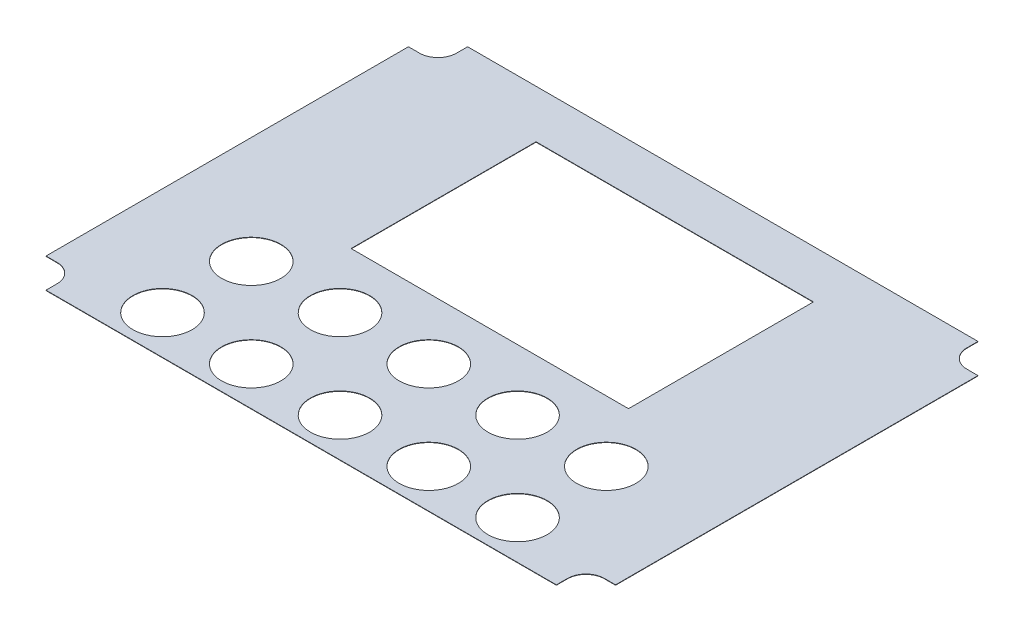
from build123d import *

# Parameters (mm, degrees)
SKETCH1_W           = 154
SKETCH1_H           = 114
BOSS_EXTRUDE1_DEPTH = 0.1
CUT_EXTRUDE1_DEPTH  = 3
SKETCH3_R           = 8
SKETCH3_W           = 75
SKETCH3_H           = 50
CUT_EXTRUDE2_DEPTH  = 1


with BuildPart() as part:
    # Sketch1 → Boss-Extrude1 (new body)
    with BuildSketch(Plane(origin=(0, 0, 0), x_dir=(1, 0, 0), z_dir=(0, 1, 0))):
        Rectangle(SKETCH1_W, SKETCH1_H)
    extrude(amount=BOSS_EXTRUDE1_DEPTH)

    # Sketch2 → Cut-Extrude1 (cut)
    with BuildSketch(Plane(origin=(0, 0.1, 0), x_dir=(1, 0, 0), z_dir=(0, 1, 0))):
        with BuildLine():
            Line((-52.05, -19.483379374), (-52.05, -25.516620626))
            ThreePointArc((-52.05, -25.516620626), (-48, -27.55), (-43.95, -25.516620626))
            Line((-43.95, -25.516620626), (-43.95, -19.483379374))
            ThreePointArc((-43.95, -19.483379374), (-48, -17.45), (-52.05, -19.483379374))
        make_face()
        with BuildLine():
            Line((-19.95, -19.483379374), (-19.95, -25.516620626))
            ThreePointArc((-19.95, -25.516620626), (-24, -27.55), (-28.05, -25.516620626))
            Line((-28.05, -25.516620626), (-28.05, -19.483379374))
            ThreePointArc((-28.05, -19.483379374), (-24, -17.45), (-19.95, -19.483379374))
        make_face()
        with BuildLine():
            Line((4.05, -19.483379374), (4.05, -25.516620626))
            ThreePointArc((4.05, -25.516620626), (0, -27.55), (-4.05, -25.516620626))
            Line((-4.05, -25.516620626), (-4.05, -19.483379374))
            ThreePointArc((-4.05, -19.483379374), (0, -17.45), (4.05, -19.483379374))
        make_face()
        with BuildLine():
            Line((28.05, -19.483379374), (28.05, -25.516620626))
            ThreePointArc((28.05, -25.516620626), (24, -27.55), (19.95, -25.516620626))
            Line((19.95, -25.516620626), (19.95, -19.483379374))
            ThreePointArc((19.95, -19.483379374), (24, -17.45), (28.05, -19.483379374))
        make_face()
        with BuildLine():
            Line((52.05, -19.483379374), (52.05, -25.516620626))
            ThreePointArc((52.05, -25.516620626), (48, -27.55), (43.95, -25.516620626))
            Line((43.95, -25.516620626), (43.95, -19.483379374))
            ThreePointArc((43.95, -19.483379374), (48, -17.45), (52.05, -19.483379374))
        make_face()
        with BuildLine():
            Line((-19.95, -43.483379374), (-19.95, -49.516620626))
            ThreePointArc((-19.95, -49.516620626), (-24, -51.55), (-28.05, -49.516620626))
            Line((-28.05, -49.516620626), (-28.05, -43.483379374))
            ThreePointArc((-28.05, -43.483379374), (-24, -41.45), (-19.95, -43.483379374))
        make_face()
        with BuildLine():
            Line((4.05, -43.483379374), (4.05, -49.516620626))
            ThreePointArc((4.05, -49.516620626), (0, -51.55), (-4.05, -49.516620626))
            Line((-4.05, -49.516620626), (-4.05, -43.483379374))
            ThreePointArc((-4.05, -43.483379374), (0, -41.45), (4.05, -43.483379374))
        make_face()
        with BuildLine():
            Line((28.05, -43.483379374), (28.05, -49.516620626))
            ThreePointArc((28.05, -49.516620626), (24, -51.55), (19.95, -49.516620626))
            Line((19.95, -49.516620626), (19.95, -43.483379374))
            ThreePointArc((19.95, -43.483379374), (24, -41.45), (28.05, -43.483379374))
        make_face()
        with BuildLine():
            Line((52.05, -43.483379374), (52.05, -49.516620626))
            ThreePointArc((52.05, -49.516620626), (48, -51.55), (43.95, -49.516620626))
            Line((43.95, -49.516620626), (43.95, -43.483379374))
            ThreePointArc((43.95, -43.483379374), (48, -41.45), (52.05, -43.483379374))
        make_face()
        with BuildLine():
            Line((-43.95, -43.483379374), (-43.95, -49.516620626))
            ThreePointArc((-43.95, -49.516620626), (-48, -51.55), (-52.05, -49.516620626))
            Line((-52.05, -49.516620626), (-52.05, -43.483379374))
            ThreePointArc((-52.05, -43.483379374), (-48, -41.45), (-43.95, -43.483379374))
        make_face()
    extrude(amount=-CUT_EXTRUDE1_DEPTH, mode=Mode.SUBTRACT)

    # Sketch3 → Cut-Extrude2 (cut)
    # profile 1 of 15: a face of its own
    with BuildSketch(Plane(origin=(0, 0.1, 0), x_dir=(1, 0, 0), z_dir=(0, 1, 0))):
        with BuildLine():
            Line((-69, 57), (-77, 57))
            Line((-77, 57), (-77, 49))
            Line((-77, 49), (-74, 49))
            ThreePointArc((-74, 49), (-70.464466094, 50.464466094), (-69, 54))
            Line((-69, 54), (-69, 57))
        make_face()
    # profile 2 of 15: a face of its own
    with BuildSketch(Plane(origin=(0, 0.1, 0), x_dir=(1, 0, 0), z_dir=(0, 1, 0))):
        with BuildLine():
            Line((77, 57), (69, 57))
            Line((69, 57), (69, 54))
            ThreePointArc((69, 54), (70.464466094, 50.464466094), (74, 49))
            Line((74, 49), (77, 49))
            Line((77, 49), (77, 57))
        make_face()
    # profile 3 of 15: a face of its own
    with BuildSketch(Plane(origin=(0, 0.1, 0), x_dir=(1, 0, 0), z_dir=(0, 1, 0))):
        with BuildLine():
            Line((77, -57), (77, -49))
            Line((77, -49), (74, -49))
            ThreePointArc((74, -49), (70.464466094, -50.464466094), (69, -54))
            Line((69, -54), (69, -57))
            Line((69, -57), (77, -57))
        make_face()
    # profile 4 of 15: a face of its own
    with BuildSketch(Plane(origin=(0, 0.1, 0), x_dir=(1, 0, 0), z_dir=(0, 1, 0))):
        with BuildLine():
            Line((-74, -49), (-77, -49))
            Line((-77, -49), (-77, -57))
            Line((-77, -57), (-69, -57))
            Line((-69, -57), (-69, -54))
            ThreePointArc((-69, -54), (-70.464466094, -50.464466094), (-74, -49))
        make_face()
    # profile 5 of 15: a face of its own
    with BuildSketch(Plane(origin=(0, 0.1, 0), x_dir=(1, 0, 0), z_dir=(0, 1, 0))):
        with Locations(Location((-48, -22.5, 0), (0, 0, 270))):
            Circle(SKETCH3_R)
        with BuildLine():
            Line((-52.05, -25.516620626), (-52.05, -19.483379374))
            ThreePointArc((-52.05, -19.483379374), (-48, -17.45), (-43.95, -19.483379374))
            Line((-43.95, -19.483379374), (-43.95, -25.516620626))
            ThreePointArc((-43.95, -25.516620626), (-48, -27.55), (-52.05, -25.516620626))
        make_face(mode=Mode.SUBTRACT)
    # profile 6 of 15: a face of its own
    with BuildSketch(Plane(origin=(0, 0.1, 0), x_dir=(1, 0, 0), z_dir=(0, 1, 0))):
        with Locations(Location((-24, -22.5, 0), (0, 0, 270))):
            Circle(SKETCH3_R)
        with BuildLine():
            Line((-28.05, -25.516620626), (-28.05, -19.483379374))
            ThreePointArc((-28.05, -19.483379374), (-24, -17.45), (-19.95, -19.483379374))
            Line((-19.95, -19.483379374), (-19.95, -25.516620626))
            ThreePointArc((-19.95, -25.516620626), (-24, -27.55), (-28.05, -25.516620626))
        make_face(mode=Mode.SUBTRACT)
    # profile 7 of 15: a face of its own
    with BuildSketch(Plane(origin=(0, 0.1, 0), x_dir=(1, 0, 0), z_dir=(0, 1, 0))):
        with Locations(Location((0, -22.5, 0), (0, 0, 270))):
            Circle(SKETCH3_R)
        with BuildLine():
            Line((-4.05, -25.516620626), (-4.05, -19.483379374))
            ThreePointArc((-4.05, -19.483379374), (0, -17.45), (4.05, -19.483379374))
            Line((4.05, -19.483379374), (4.05, -25.516620626))
            ThreePointArc((4.05, -25.516620626), (0, -27.55), (-4.05, -25.516620626))
        make_face(mode=Mode.SUBTRACT)
    # profile 8 of 15: a face of its own
    with BuildSketch(Plane(origin=(0, 0.1, 0), x_dir=(1, 0, 0), z_dir=(0, 1, 0))):
        with Locations(Location((24, -22.5, 0), (0, 0, 270))):
            Circle(SKETCH3_R)
        with BuildLine():
            Line((19.95, -25.516620626), (19.95, -19.483379374))
            ThreePointArc((19.95, -19.483379374), (24, -17.45), (28.05, -19.483379374))
            Line((28.05, -19.483379374), (28.05, -25.516620626))
            ThreePointArc((28.05, -25.516620626), (24, -27.55), (19.95, -25.516620626))
        make_face(mode=Mode.SUBTRACT)
    # profile 9 of 15: a face of its own
    with BuildSketch(Plane(origin=(0, 0.1, 0), x_dir=(1, 0, 0), z_dir=(0, 1, 0))):
        with Locations(Location((48, -22.5, 0), (0, 0, 270))):
            Circle(SKETCH3_R)
        with BuildLine():
            Line((43.95, -25.516620626), (43.95, -19.483379374))
            ThreePointArc((43.95, -19.483379374), (48, -17.45), (52.05, -19.483379374))
            Line((52.05, -19.483379374), (52.05, -25.516620626))
            ThreePointArc((52.05, -25.516620626), (48, -27.55), (43.95, -25.516620626))
        make_face(mode=Mode.SUBTRACT)
    # profile 10 of 15: a face of its own
    with BuildSketch(Plane(origin=(0, 0.1, 0), x_dir=(1, 0, 0), z_dir=(0, 1, 0))):
        with Locations(Location((48, -46.5, 0), (0, 0, 270))):
            Circle(SKETCH3_R)
        with BuildLine():
            Line((43.95, -49.516620626), (43.95, -43.483379374))
            ThreePointArc((43.95, -43.483379374), (48, -41.45), (52.05, -43.483379374))
            Line((52.05, -43.483379374), (52.05, -49.516620626))
            ThreePointArc((52.05, -49.516620626), (48, -51.55), (43.95, -49.516620626))
        make_face(mode=Mode.SUBTRACT)
    # profile 11 of 15: a face of its own
    with BuildSketch(Plane(origin=(0, 0.1, 0), x_dir=(1, 0, 0), z_dir=(0, 1, 0))):
        with Locations(Location((24, -46.5, 0), (0, 0, 270))):
            Circle(SKETCH3_R)
        with BuildLine():
            Line((19.95, -49.516620626), (19.95, -43.483379374))
            ThreePointArc((19.95, -43.483379374), (24, -41.45), (28.05, -43.483379374))
            Line((28.05, -43.483379374), (28.05, -49.516620626))
            ThreePointArc((28.05, -49.516620626), (24, -51.55), (19.95, -49.516620626))
        make_face(mode=Mode.SUBTRACT)
    # profile 12 of 15: a face of its own
    with BuildSketch(Plane(origin=(0, 0.1, 0), x_dir=(1, 0, 0), z_dir=(0, 1, 0))):
        with Locations(Location((0, -46.5, 0), (0, 0, 270))):
            Circle(SKETCH3_R)
        with BuildLine():
            Line((-4.05, -49.516620626), (-4.05, -43.483379374))
            ThreePointArc((-4.05, -43.483379374), (0, -41.45), (4.05, -43.483379374))
            Line((4.05, -43.483379374), (4.05, -49.516620626))
            ThreePointArc((4.05, -49.516620626), (0, -51.55), (-4.05, -49.516620626))
        make_face(mode=Mode.SUBTRACT)
    # profile 13 of 15: a face of its own
    with BuildSketch(Plane(origin=(0, 0.1, 0), x_dir=(1, 0, 0), z_dir=(0, 1, 0))):
        with Locations(Location((-24, -46.5, 0), (0, 0, 270))):
            Circle(SKETCH3_R)
        with BuildLine():
            Line((-28.05, -49.516620626), (-28.05, -43.483379374))
            ThreePointArc((-28.05, -43.483379374), (-24, -41.45), (-19.95, -43.483379374))
            Line((-19.95, -43.483379374), (-19.95, -49.516620626))
            ThreePointArc((-19.95, -49.516620626), (-24, -51.55), (-28.05, -49.516620626))
        make_face(mode=Mode.SUBTRACT)
    # profile 14 of 15: a face of its own
    with BuildSketch(Plane(origin=(0, 0.1, 0), x_dir=(1, 0, 0), z_dir=(0, 1, 0))):
        with Locations(Location((-48, -46.5, 0), (0, 0, 270))):
            Circle(SKETCH3_R)
        with BuildLine():
            Line((-52.05, -49.516620626), (-52.05, -43.483379374))
            ThreePointArc((-52.05, -43.483379374), (-48, -41.45), (-43.95, -43.483379374))
            Line((-43.95, -43.483379374), (-43.95, -49.516620626))
            ThreePointArc((-43.95, -49.516620626), (-48, -51.55), (-52.05, -49.516620626))
        make_face(mode=Mode.SUBTRACT)
    # profile 15 of 15: a face of its own
    with BuildSketch(Plane(origin=(0, 0.1, 0), x_dir=(1, 0, 0), z_dir=(0, 1, 0))):
        with Locations((0, 19)):
            Rectangle(SKETCH3_W, SKETCH3_H)
    extrude(amount=-CUT_EXTRUDE2_DEPTH, mode=Mode.SUBTRACT)


solid = part.part
